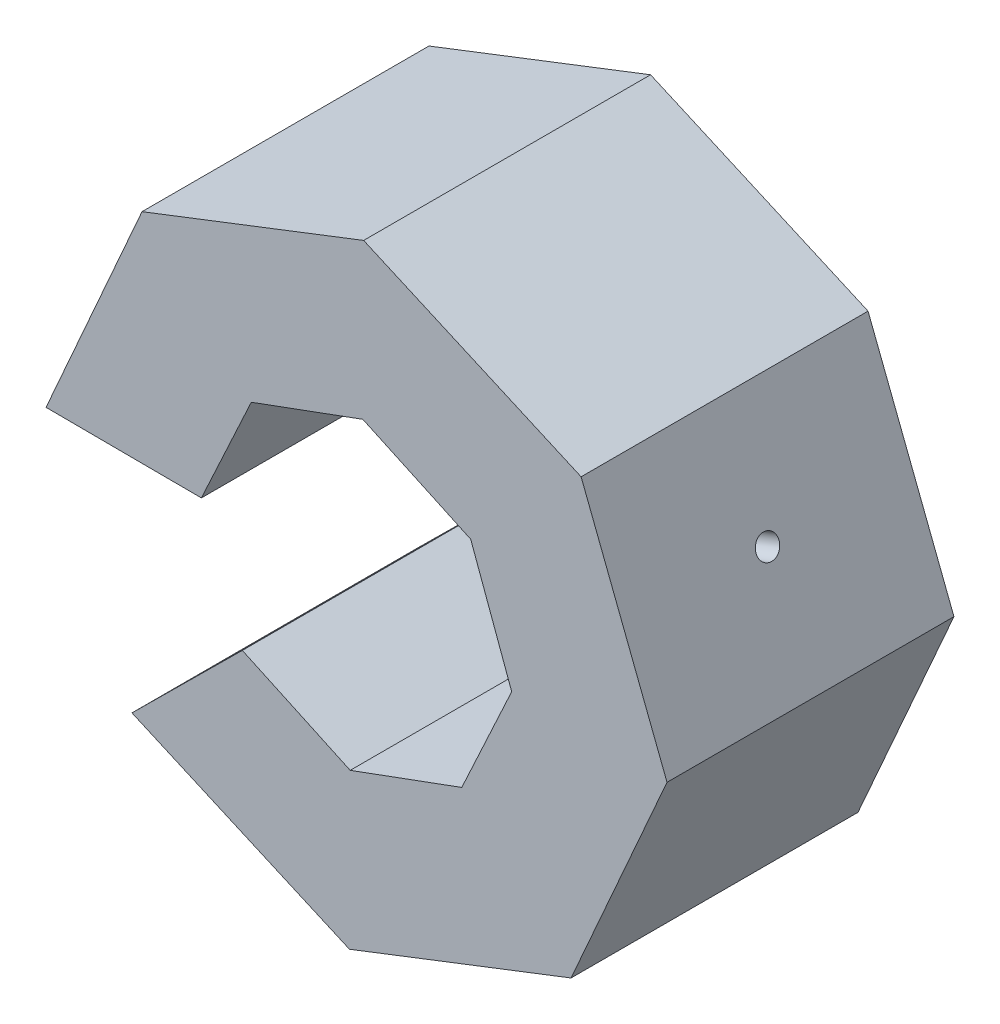
from build123d import *

# Parameters (mm, degrees)
BOSS_EXTRUDE1_DEPTH = 10
SKETCH2_R           = 0.4
CUT_EXTRUDE1_DEPTH  = 602


with BuildPart() as part:
    # Sketch1 → Boss-Extrude1 (new body)
    with BuildSketch(Plane.XY):
        Polygon((-3.979511218, -3.667807567), (-0.220407765, -5.407470971), (3.667807567, -3.979511218), (5.407470971, -0.220407765), (3.979511218, 3.667807567), (0.220407765, 5.407470971), (-3.667807567, 3.979511218), (-5.407470971, 0.220407765), (-10.821084843, 0.247811103), (-7.476433561, 7.826891384), (0.247811103, 10.821084843), (7.826891384, 7.476433561), (10.821084843, -0.247811103), (7.476433561, -7.826891384), (-0.247811103, -10.821084843), (-7.826891384, -7.476433561), align=None)
    extrude(amount=-BOSS_EXTRUDE1_DEPTH)

    # Sketch2 → Cut-Extrude1 (cut)
    with BuildSketch(Plane(origin=(9.323988114, 3.614311229, 0), x_dir=(0, 0, -1), z_dir=(0.9323988113551661, 0.361431122876093, 0))):
        with Locations(Location((5, 0, 0), (0, 0, 90))):
            Circle(SKETCH2_R)
    extrude(amount=-CUT_EXTRUDE1_DEPTH, mode=Mode.SUBTRACT)


solid = part.part
